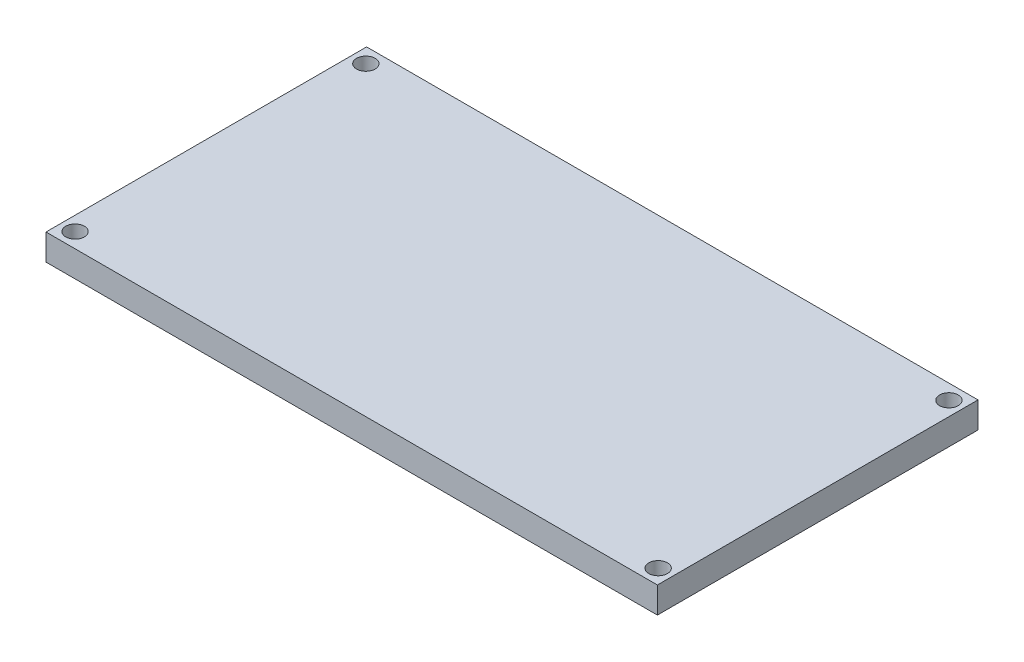
from build123d import *

# Parameters (mm, degrees)
SKETCH2_W               = 104.14
SKETCH2_H               = 54.61
BOSS_EXTRUDE1_DEPTH     = 4.445
CUT_EXTRUDE1_DEPTH      = 59.962750529
CUT_EXTRUDE1_DEPTH_BACK = 59.962750529
SKETCH3_R               = 1.5875


with BuildPart() as part:
    # Sketch2 → Boss-Extrude1 (new body)
    with BuildSketch(Plane(origin=(0, 0, 0), x_dir=(1, 0, 0), z_dir=(0, 1, 0))):
        Rectangle(SKETCH2_W, SKETCH2_H)
    extrude(amount=BOSS_EXTRUDE1_DEPTH)

    # Sketch3 → Cut-Extrude1 (cut, two sides: drawn at the far end of the back side and taken through both)
    with BuildSketch(Plane(origin=(0, 4.445, 0), x_dir=(1, 0, 0), z_dir=(0, 1, 0)).offset(-CUT_EXTRUDE1_DEPTH_BACK)):
        with Locations(Location((-49.657, 24.765, 0), (0, 0, 270))):
            Circle(SKETCH3_R)
        with Locations(Location((49.657, 24.765, 0), (0, 0, 270))):
            Circle(SKETCH3_R)
        with Locations(Location((49.657, -24.765, 0), (0, 0, 270))):
            Circle(SKETCH3_R)
        with Locations(Location((-49.657, -24.765, 0), (0, 0, 270))):
            Circle(SKETCH3_R)
    extrude(amount=CUT_EXTRUDE1_DEPTH + CUT_EXTRUDE1_DEPTH_BACK, mode=Mode.SUBTRACT)


solid = part.part
